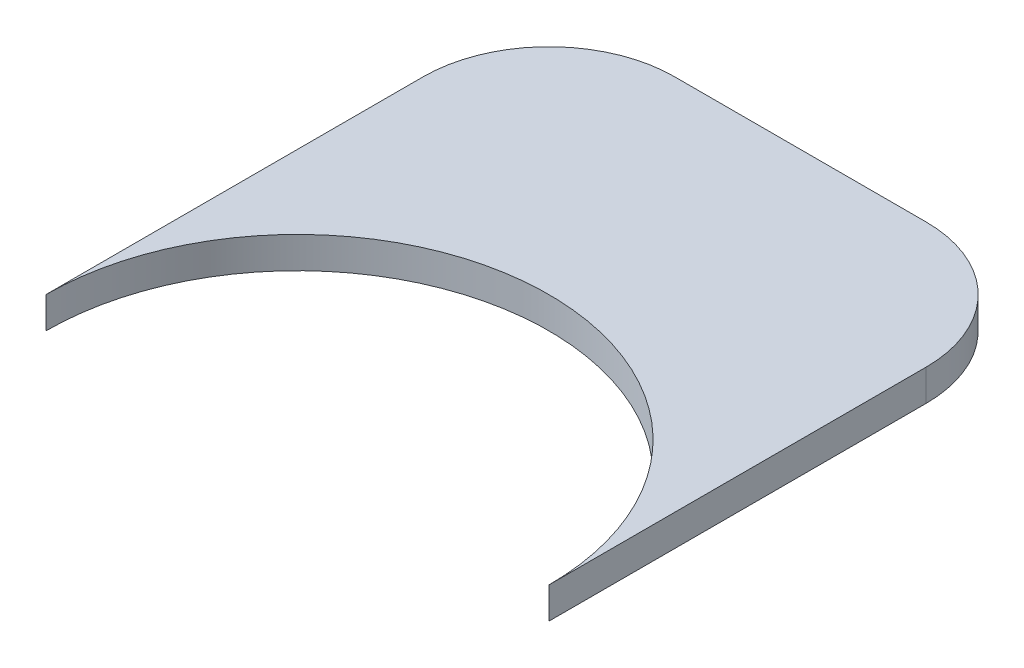
from build123d import *

# Parameters (mm, degrees)
BOSS_EXTRUDE1_DEPTH = 1.5875


with BuildPart() as part:
    # Sketch1 → Boss-Extrude1 (new body)
    with BuildSketch(Plane(origin=(0, 0, 0), x_dir=(1, 0, 0), z_dir=(0, 1, 0))):
        with BuildLine():
            Line((-12.7, -9.525), (-12.7, 9.525))
            ThreePointArc((-12.7, 9.525), (-10.840128061, 14.015128061), (-6.35, 15.875))
            Line((-6.35, 15.875), (6.35, 15.875))
            ThreePointArc((6.35, 15.875), (10.840128061, 14.015128061), (12.7, 9.525))
            Line((12.7, 9.525), (12.7, -9.525))
            ThreePointArc((12.7, -9.525), (0, 3.175), (-12.7, -9.525))
        make_face()
    extrude(amount=BOSS_EXTRUDE1_DEPTH)


solid = part.part
